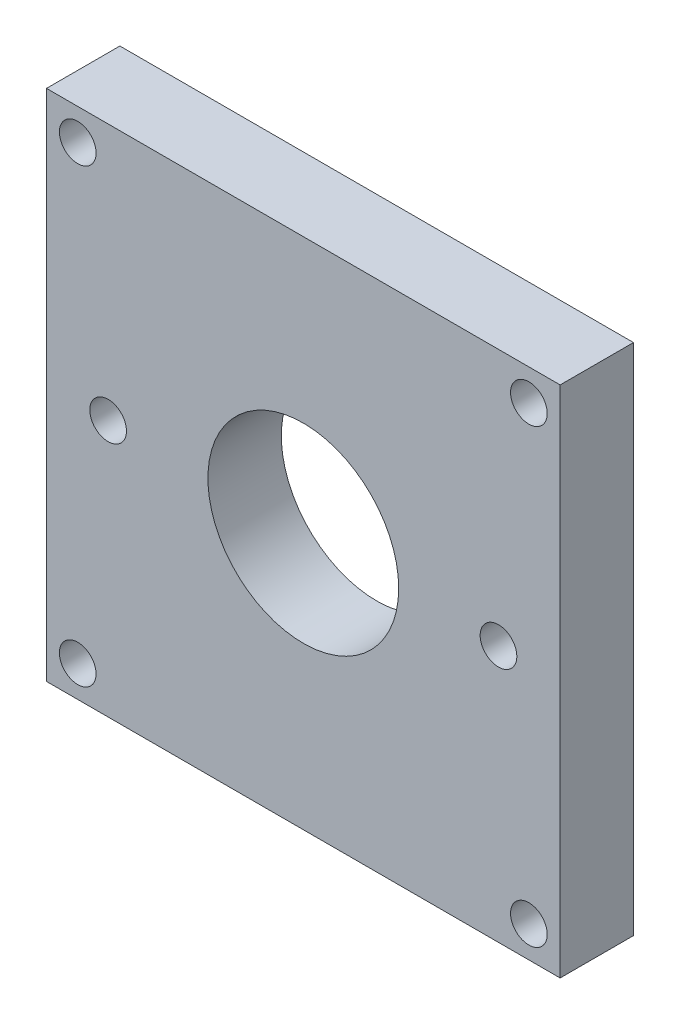
from build123d import *

# Parameters (mm, degrees)
CROQUIS1_W              = 35
CROQUIS1_H              = 35
CROQUIS1_R              = 1.25
CROQUIS1_R_2            = 6.5
SALIENTE_EXTRUIR1_DEPTH = 5


with BuildPart() as part:
    # Croquis1 → Saliente-Extruir1 (new body)
    with BuildSketch(Plane.XY):
        Rectangle(CROQUIS1_W, CROQUIS1_H)
        with Locations((-15.37, 15.37)):
            Circle(CROQUIS1_R, mode=Mode.SUBTRACT)
        with Locations((15.37, 15.37)):
            Circle(CROQUIS1_R, mode=Mode.SUBTRACT)
        with Locations((15.37, -15.37)):
            Circle(CROQUIS1_R, mode=Mode.SUBTRACT)
        with Locations((-15.37, -15.37)):
            Circle(CROQUIS1_R, mode=Mode.SUBTRACT)
        Circle(CROQUIS1_R_2, mode=Mode.SUBTRACT)
        with Locations((13.3, 0)):
            Circle(CROQUIS1_R, mode=Mode.SUBTRACT)
        with Locations((-13.3, 0)):
            Circle(CROQUIS1_R, mode=Mode.SUBTRACT)
    extrude(amount=SALIENTE_EXTRUIR1_DEPTH)


solid = part.part
